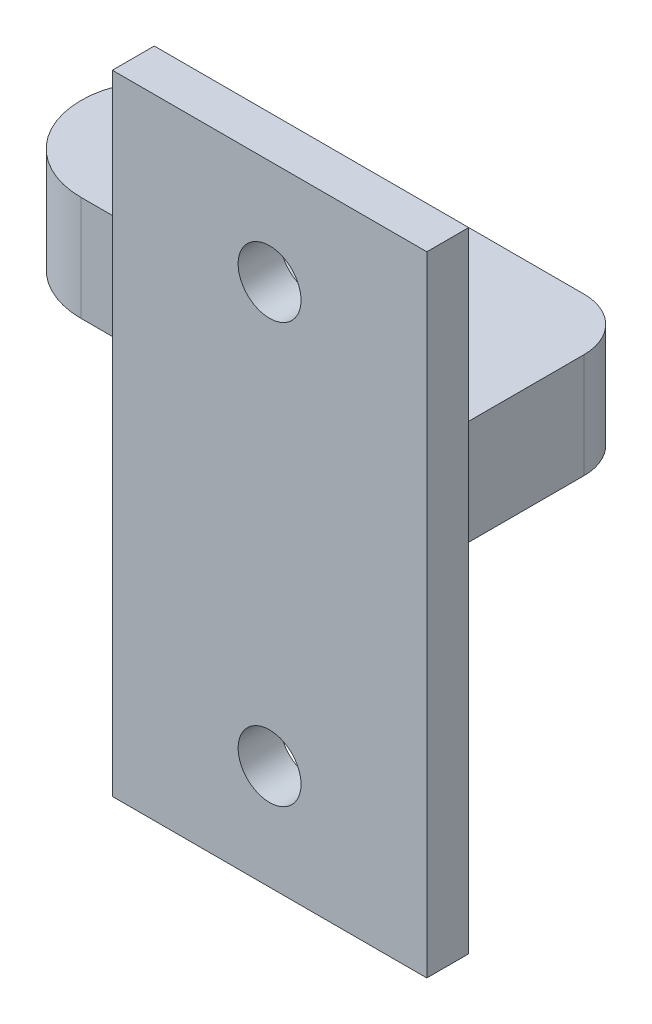
from build123d import *

# Parameters (mm, degrees)
SKETCH1_W           = 15
SKETCH1_H           = 30
SKETCH1_R           = 1.5
BOSS_EXTRUDE1_DEPTH = 2
SKETCH2_R           = 1.5
BOSS_EXTRUDE2_DEPTH = 2.5


with BuildPart() as part:
    # Sketch1 → Boss-Extrude1 (new body)
    with BuildSketch(Plane.XY):
        Rectangle(SKETCH1_W, SKETCH1_H)
        with Locations((0, 10)):
            Circle(SKETCH1_R, mode=Mode.SUBTRACT)
        with Locations((0, -10)):
            Circle(SKETCH1_R, mode=Mode.SUBTRACT)
    extrude(amount=BOSS_EXTRUDE1_DEPTH)

    # Sketch2 → Boss-Extrude2 (add, symmetric)
    with BuildSketch(Plane(origin=(0, 0, 0), x_dir=(1, 0, 0), z_dir=(0, 1, 0))):
        with BuildLine():
            Line((-3, 0), (3, 0))
            Line((3, 0), (3, 10))
            ThreePointArc((3, 10), (2.267766953, 11.767766953), (0.5, 12.5))
            Line((0.5, 12.5), (-15.5, 12.5))
            ThreePointArc((-15.5, 12.5), (-19.5, 8.5), (-15.5, 4.5))
            Line((-15.5, 4.5), (-7.5, 4.5))
            ThreePointArc((-7.5, 4.5), (-4.318019485, 3.181980515), (-3, 0))
        make_face()
        with Locations(Location((-15.5, 8.5, 0), (0, 0, 270))):
            Circle(SKETCH2_R, mode=Mode.SUBTRACT)
    extrude(amount=BOSS_EXTRUDE2_DEPTH, both=True)


solid = part.part
